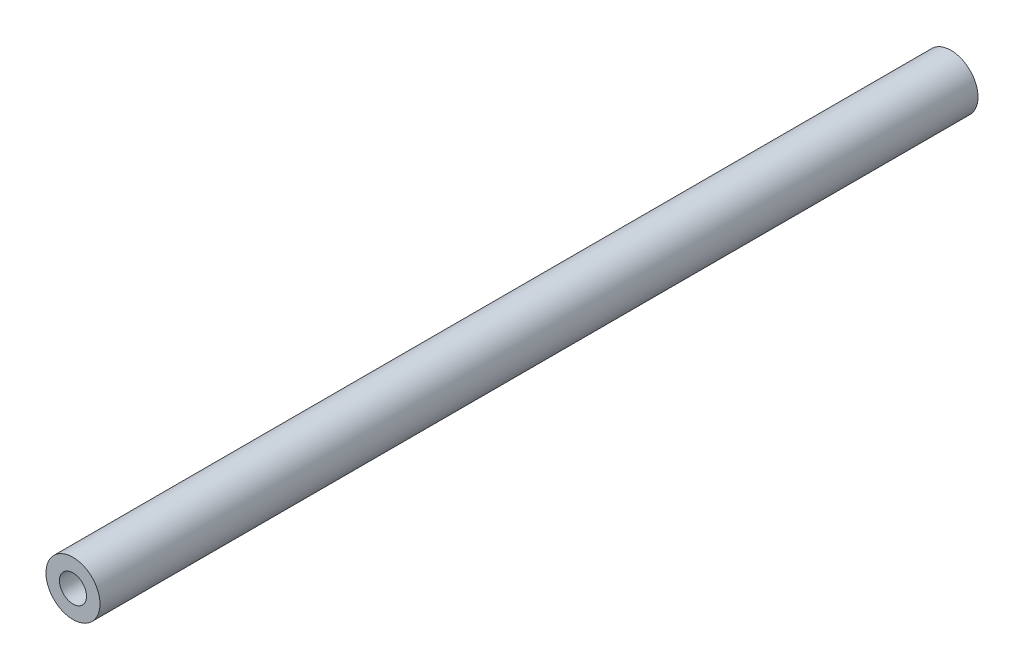
from build123d import *

# Parameters (mm, degrees)
SKETCH_1_R          = 8
EXTRUDE_1_DEPTH     = 260
SKETCH_2_R          = 4
CUT_EXTRUDE_1_DEPTH = 20
CUT_EXTRUDE_START   = -20
SKETCH_3_R          = 4
CUT_EXTRUDE_2_DEPTH = 20


with BuildPart() as part:
    # 草图1 → 凸台-拉伸1 (new body)
    with BuildSketch(Plane.XY):
        Circle(SKETCH_1_R)
    extrude(amount=EXTRUDE_1_DEPTH)

    # 草图2 → 切除-拉伸1 (cut)
    with BuildSketch(Plane.XY.offset(260)):
        Circle(SKETCH_2_R)
    extrude(amount=-CUT_EXTRUDE_1_DEPTH, mode=Mode.SUBTRACT)

    # 草图3 → 切除-拉伸2 (cut)
    with BuildSketch(Plane(origin=(0, 0, 0), x_dir=(-1, 0, 0), z_dir=(0, 0, -1)).offset(CUT_EXTRUDE_START)):
        with Locations(Location((0, 0, 0), (0, 0, 180))):
            Circle(SKETCH_3_R)
    extrude(amount=CUT_EXTRUDE_2_DEPTH, mode=Mode.SUBTRACT)


solid = part.part
